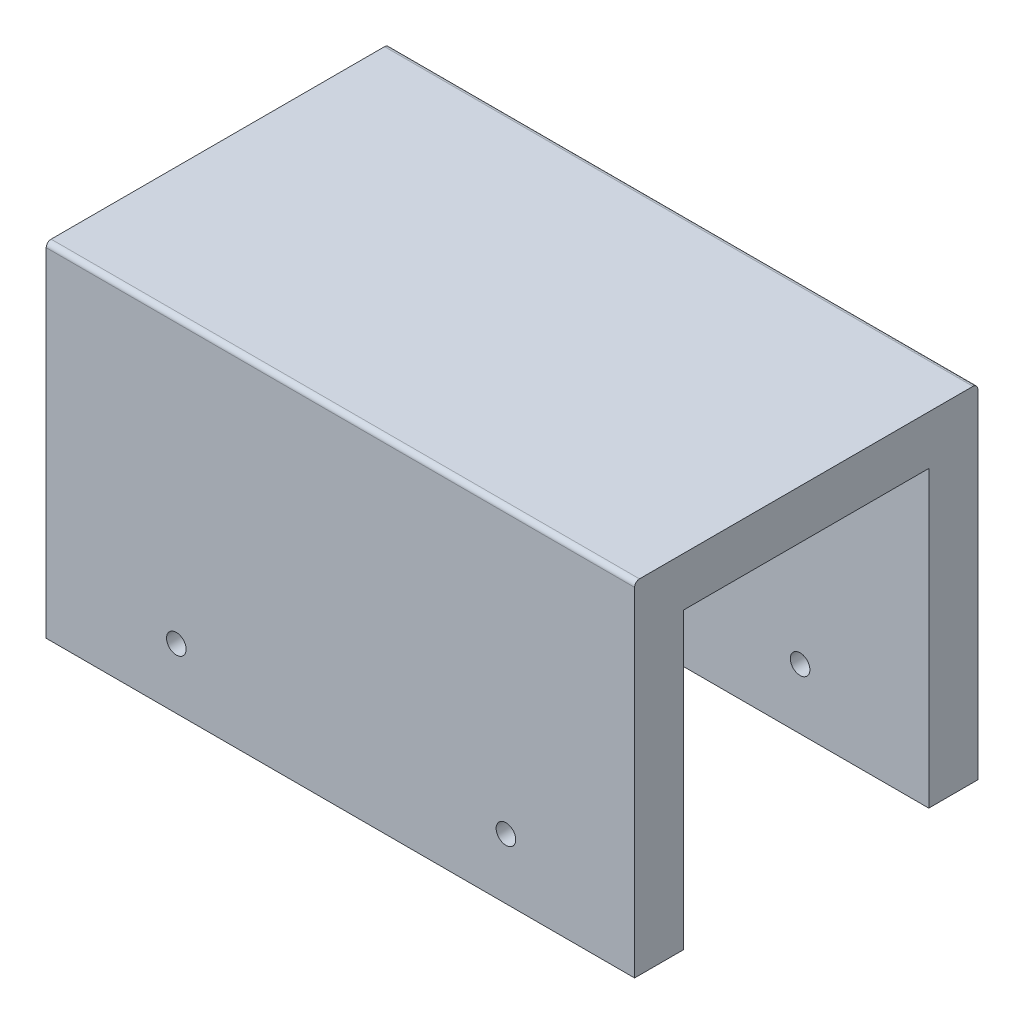
from build123d import *

# Parameters (mm, degrees)
EXTRUDE_THIN1_DEPTH = 120
SKETCH5_R           = 2
CUT_EXTRUDE1_DEPTH  = 145.568322948
FILLET1_R           = 1


with BuildPart() as part:
    # Sketch3 → Extrude-Thin1 (new body)
    with BuildSketch(Plane(origin=(0, 0, 0), x_dir=(0, 0, -1), z_dir=(1, 0, 0))):
        Polygon((-25, -30), (-25, 30), (25, 30), (25, -30), (35, -30), (35, 40), (-35, 40), (-35, -30), align=None)
    extrude(amount=EXTRUDE_THIN1_DEPTH)

    # Sketch5 → Cut-Extrude1 (cut, through all)
    with BuildSketch(Plane.XY.offset(35)):
        with Locations((26.536588231, -17.686450881)):
            Circle(SKETCH5_R)
        with Locations((93.76132228, -17.686450881)):
            Circle(SKETCH5_R)
    extrude(amount=-CUT_EXTRUDE1_DEPTH, mode=Mode.SUBTRACT)

    # Fillet1
    fillet1_edges = [part.edges().sort_by_distance(p)[0] for p in [
        (60, 40, 35),
        (60, 40, -35),
    ]]
    fillet(fillet1_edges, radius=FILLET1_R)


solid = part.part
